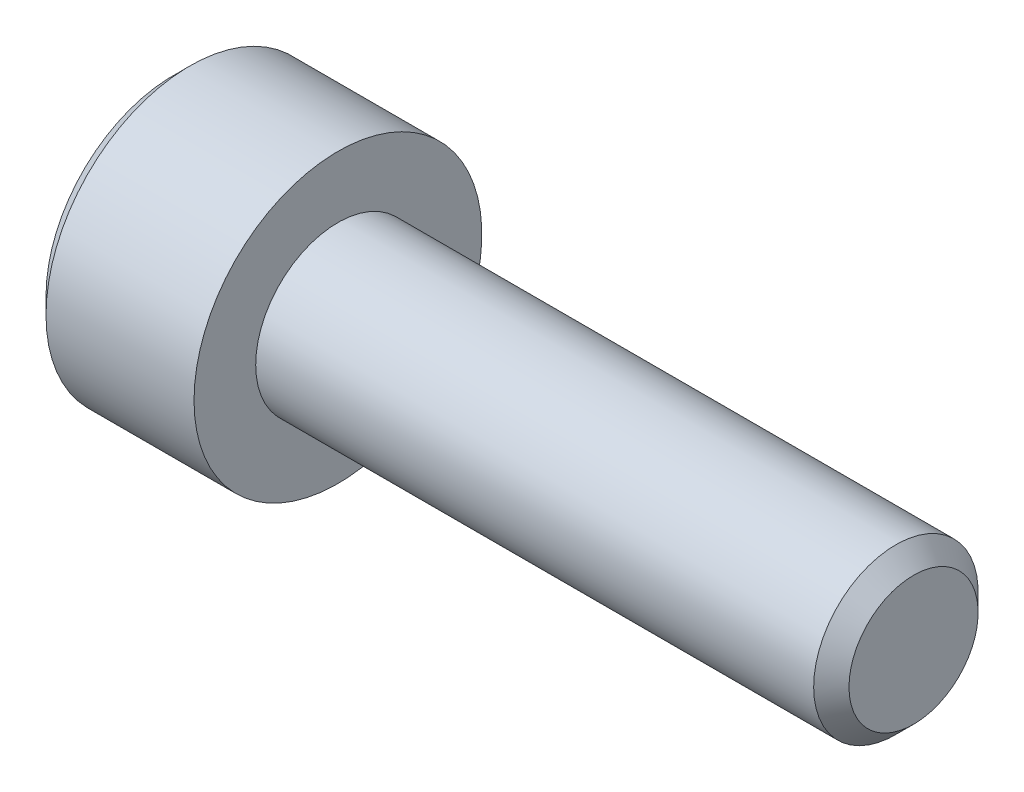
from build123d import *

# Parameters (mm, degrees)
CUT_EXTRUDE1_DEPTH = 2


with BuildPart() as part:
    # Sketch1 → Revolve1 (revolve)
    with BuildSketch(Plane.XY):
        Polygon((-4, 0), (14, 0), (14, -1.5705), (13.5705, -2), (0, -2), (0, -3.5), (-3.6, -3.5), (-4, -3.1), align=None)
    revolve(axis=Axis((-4.9, 0, 0), (1, 0, 0)))

    # Sketch2 → Cut-Extrude1 (cut)
    with BuildSketch(Plane.ZY.offset(4)):
        Polygon((0, 1.732050808), (-1.5, 0.866025404), (-1.5, -0.866025404), (0, -1.732050808), (1.5, -0.866025404), (1.5, 0.866025404), align=None)
    extrude(amount=-CUT_EXTRUDE1_DEPTH, mode=Mode.SUBTRACT)


solid = part.part
